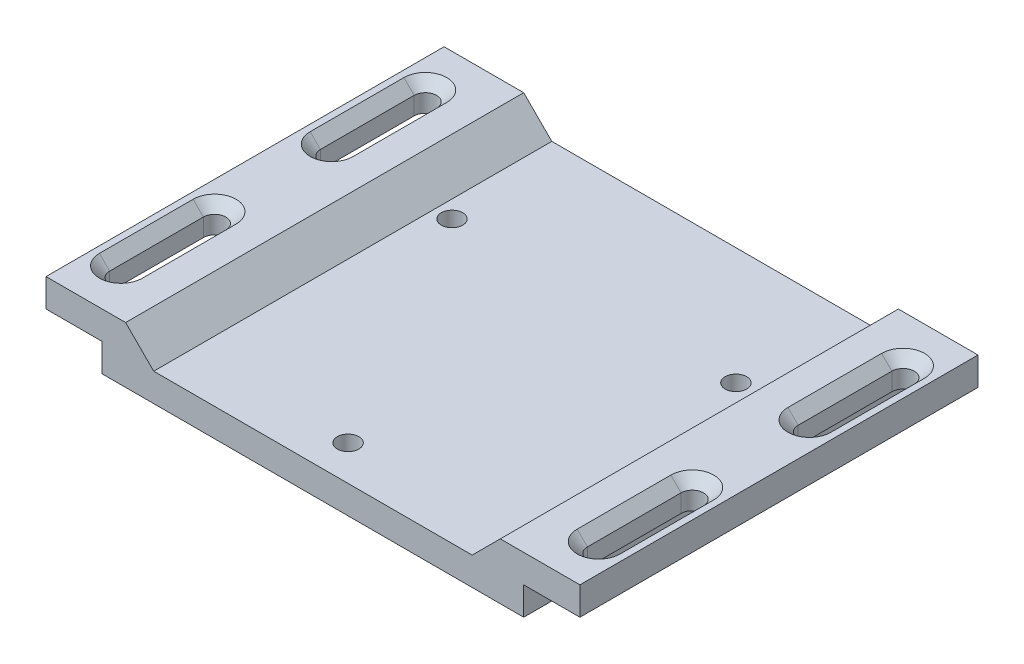
from build123d import *

# Parameters (mm, degrees)
SKETCH1_W                                            = 90
SKETCH1_H                                            = 85
BOSS_EXTRUDE1_DEPTH                                  = 6
F_4_6_4_6_DIAMETER_HOLE1_D                           = 4.6
BOSS_EXTRUDE2_DEPTH                                  = 85
CSK_FOR_M4_HEX_SOCKET_COUNTERSUNK_HEAD_S_D           = 4.8
CSK_FOR_M4_HEX_SOCKET_COUNTERSUNK_HEAD_S_CSINK_D     = 9.18
CSK_FOR_M4_HEX_SOCKET_COUNTERSUNK_HEAD_S_CSINK_ANGLE = 90
CUT_EXTRUDE1_DEPTH                                   = 20
CUT_EXTRUDE2_START                                   = -65
CUT_EXTRUDE2_DEPTH                                   = 20


with BuildPart() as part:
    # Sketch1 → Boss-Extrude1 (new body)
    with BuildSketch(Plane(origin=(0, 0, 0), x_dir=(1, 0, 0), z_dir=(0, 1, 0))):
        with Locations((45, 42.5)):
            Rectangle(SKETCH1_W, SKETCH1_H)
    extrude(amount=BOSS_EXTRUDE1_DEPTH)

    # Ø4.6 (4.6) Diameter Hole1 (through all)
    with Locations(Plane(origin=(0, 6, 0), x_dir=(1, 0, 0), z_dir=(0, 1, 0))):
        with Locations((75.310889132, 60), (45, 7.5), (14.689110868, 60)):
            Hole(F_4_6_4_6_DIAMETER_HOLE1_D / 2)

    # Sketch8 → Boss-Extrude2 (add)
    with BuildSketch(Plane.XY):
        Polygon((5, 12), (11, 6), (0, 6), (-12, 6), (-12, 12), align=None)
        Polygon((79, 6), (90, 6), (102, 6), (102, 12), (85, 12), align=None)
    extrude(amount=-BOSS_EXTRUDE2_DEPTH)

    # CSK for M4 Hex Socket Countersunk Head Screw1 (through all)
    with Locations(Plane(origin=(0, 12, 0), x_dir=(1, 0, 0), z_dir=(0, 1, 0))):
        with Locations((-6, 10), (-6, 75), (96, 75), (96, 10), (-6, 30), (-6, 55), (96, 55), (96, 30)):
            CounterSinkHole(CSK_FOR_M4_HEX_SOCKET_COUNTERSUNK_HEAD_S_D / 2, CSK_FOR_M4_HEX_SOCKET_COUNTERSUNK_HEAD_S_CSINK_D / 2, counter_sink_angle=CSK_FOR_M4_HEX_SOCKET_COUNTERSUNK_HEAD_S_CSINK_ANGLE)

    # Sketch16 → Cut-Extrude1 (cut)
    with BuildSketch(Plane(origin=(0, 0, -10), x_dir=(0, 1, 0), z_dir=(0, 0, 1))):
        Polygon((6, 8.4), (6, 3.6), (9.81, 3.6), (12, 1.41), (26, 24.59), (9.81, 8.4), align=None)
        Polygon((12, -91.41), (26, -114.59), (9.81, -98.4), (6, -98.4), (6, -93.6), (9.81, -93.6), align=None)
    extrude(amount=-CUT_EXTRUDE1_DEPTH, mode=Mode.SUBTRACT)

    # Sketch16<4> → Cut-Extrude2 (cut)
    with BuildSketch(Plane(origin=(0, 0, -10), x_dir=(0, 1, 0), z_dir=(0, 0, 1)).offset(CUT_EXTRUDE2_START)):
        Polygon((6, 8.4), (6, 3.6), (9.81, 3.6), (12, 1.41), (26, 24.59), (9.81, 8.4), align=None)
        Polygon((26, -114.59), (9.81, -98.4), (6, -98.4), (6, -93.6), (9.81, -93.6), (12, -91.41), align=None)
    extrude(amount=CUT_EXTRUDE2_DEPTH, mode=Mode.SUBTRACT)


solid = part.part
